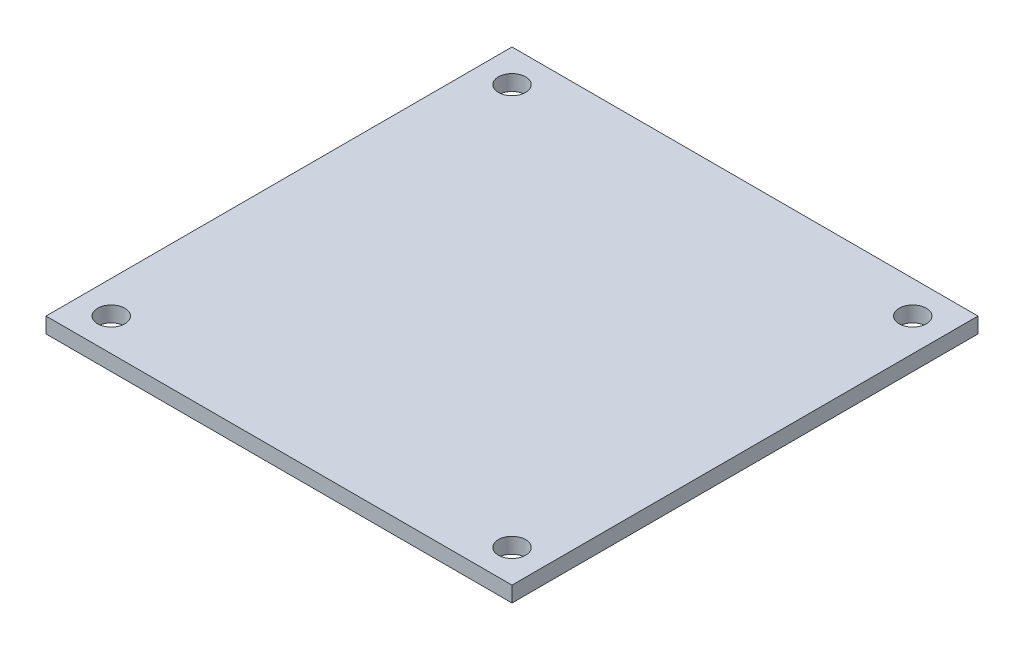
from build123d import *

# Parameters (mm, degrees)
SKETCH_1_W          = 60
SKETCH_1_H          = 60
EXTRUDE_1_DEPTH     = 2
SKETCH_2_R          = 1.75
CUT_EXTRUDE_1_DEPTH = 2


with BuildPart() as part:
    # 草图1 → 凸台-拉伸1 (new body)
    with BuildSketch(Plane(origin=(0, 0, 0), x_dir=(1, 0, 0), z_dir=(0, 1, 0))):
        Rectangle(SKETCH_1_W, SKETCH_1_H)
    extrude(amount=EXTRUDE_1_DEPTH)

    # 草图2 → 切除-拉伸1 (cut)
    with BuildSketch(Plane.XZ):
        with Locations(Location((-25.8, 25.8, 0), (0, 0, 270))):
            Circle(SKETCH_2_R)
        with Locations(Location((25.8, 25.8, 0), (0, 0, 90))):
            Circle(SKETCH_2_R)
        with Locations(Location((25.8, -25.8, 0), (0, 0, 270))):
            Circle(SKETCH_2_R)
        with Locations(Location((-25.8, -25.8, 0), (0, 0, 90))):
            Circle(SKETCH_2_R)
    extrude(amount=-CUT_EXTRUDE_1_DEPTH, mode=Mode.SUBTRACT)


solid = part.part
